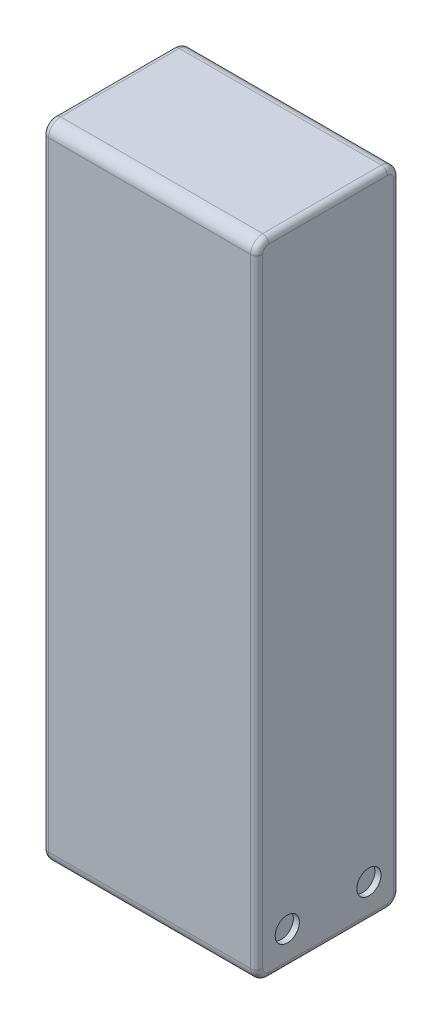
from build123d import *

# Parameters (mm, degrees)
SKETCH1_W           = 45
SKETCH1_H           = 30
BOSS_EXTRUDE1_DEPTH = 67.5
FILLET1_R           = 2.54
FILLET2_R           = 1.27
SKETCH2_R           = 2.54
CUT_EXTRUDE1_DEPTH  = 1.27


with BuildPart() as part:
    # Sketch1 → Boss-Extrude1 (new, symmetric)
    with BuildSketch(Plane(origin=(0, 0, 0), x_dir=(1, 0, 0), z_dir=(0, 1, 0))):
        Rectangle(SKETCH1_W, SKETCH1_H)
    extrude(amount=BOSS_EXTRUDE1_DEPTH, both=True)

    # Fillet1
    fillet1_edges = [part.edges().sort_by_distance(p)[0] for p in [
        (0, 67.5, 15),
        (0, -67.5, 15),
        (0, -67.5, -15),
        (0, 67.5, -15),
    ]]
    fillet(fillet1_edges, radius=FILLET1_R)

    # Fillet2
    fillet2_edges = [part.edges().sort_by_distance(p)[0] for p in [
        (22.5, 0, 15),
        (-22.5, 0, 15),
        (22.5, -67.5, 0),
        (22.5, 0, -15),
        (22.5, 67.5, 0),
        (22.5, 66.756051224, -14.256051224),
        (22.5, 66.756051224, 14.256051224),
        (22.5, -66.756051224, -14.256051224),
        (22.5, -66.756051224, 14.256051224),
        (-22.5, -67.5, 0),
        (-22.5, 67.5, 0),
        (-22.5, 0, -15),
        (-22.5, 66.756051224, -14.256051224),
        (-22.5, 66.756051224, 14.256051224),
        (-22.5, -66.756051224, -14.256051224),
        (-22.5, -66.756051224, 14.256051224),
    ]]
    fillet(fillet2_edges, radius=FILLET2_R)

    # Sketch2 → Cut-Extrude1 (cut)
    with BuildSketch(Plane(origin=(22.5, 0, 0), x_dir=(0, 0, -1), z_dir=(1, 0, 0))):
        with Locations((8.5725, -60.325)):
            Circle(SKETCH2_R)
        with Locations((-8.5725, -60.325)):
            Circle(SKETCH2_R)
    extrude(amount=-CUT_EXTRUDE1_DEPTH, mode=Mode.SUBTRACT)


solid = part.part
